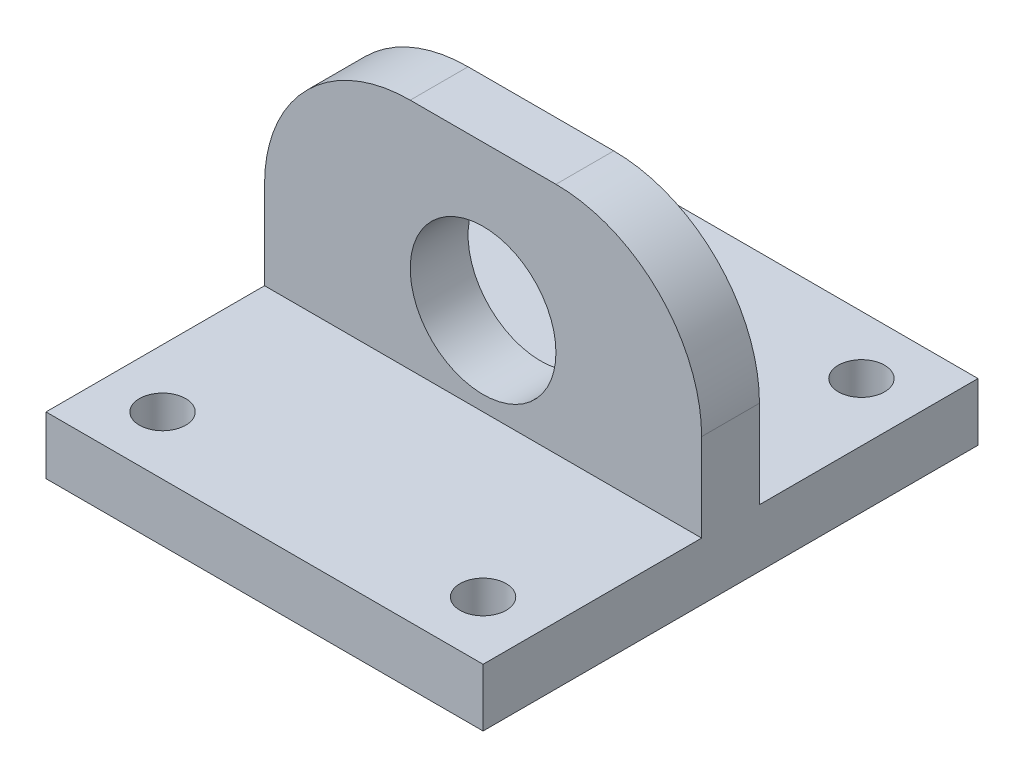
from build123d import *

# Parameters (mm, degrees)
CROQUIS1_R              = 10
SALIENTE_EXTRUIR1_DEPTH = 3.96875
CROQUIS3_W              = 30
CROQUIS3_H              = 7.9375
SALIENTE_EXTRUIR2_DEPTH = 30
CROQUIS4_R              = 3.175
CORTAR_EXTRUIR1_DEPTH   = 60


with BuildPart() as part:
    # Croquis1 → Saliente-Extruir1 (new, symmetric)
    with BuildSketch(Plane.XY):
        with BuildLine():
            Line((-30, -20), (30, -20))
            Line((30, -20), (30, 0))
            ThreePointArc((30, 0), (24.142135624, 14.142135624), (10, 20))
            Line((10, 20), (-10, 20))
            ThreePointArc((-10, 20), (-24.142135624, 14.142135624), (-30, 0))
            Line((-30, 0), (-30, -20))
        make_face()
        Circle(CROQUIS1_R, mode=Mode.SUBTRACT)
    extrude(amount=SALIENTE_EXTRUIR1_DEPTH, both=True)

    # Croquis3 → Saliente-Extruir2 (add, symmetric)
    with BuildSketch(Plane(origin=(0, 0, 0), x_dir=(0, 0, -1), z_dir=(1, 0, 0))):
        with Locations((-18.96875, -16.03125)):
            Rectangle(CROQUIS3_W, CROQUIS3_H)
        with Locations((18.96875, -16.03125)):
            Rectangle(CROQUIS3_W, CROQUIS3_H)
    extrude(amount=SALIENTE_EXTRUIR2_DEPTH, both=True)

    # Croquis4 → Cortar-Extruir1 (cut)
    with BuildSketch(Plane.XZ.offset(20)):
        with Locations(Location((-22, 25.96875, 0), (0, 0, 270))):
            Circle(CROQUIS4_R)
        with Locations(Location((22, 25.96875, 0), (0, 0, 270))):
            Circle(CROQUIS4_R)
        with Locations(Location((22, -25.96875, 0), (0, 0, 270))):
            Circle(CROQUIS4_R)
        with Locations(Location((-22, -25.96875, 0), (0, 0, 270))):
            Circle(CROQUIS4_R)
    extrude(amount=-CORTAR_EXTRUIR1_DEPTH, mode=Mode.SUBTRACT)


solid = part.part
